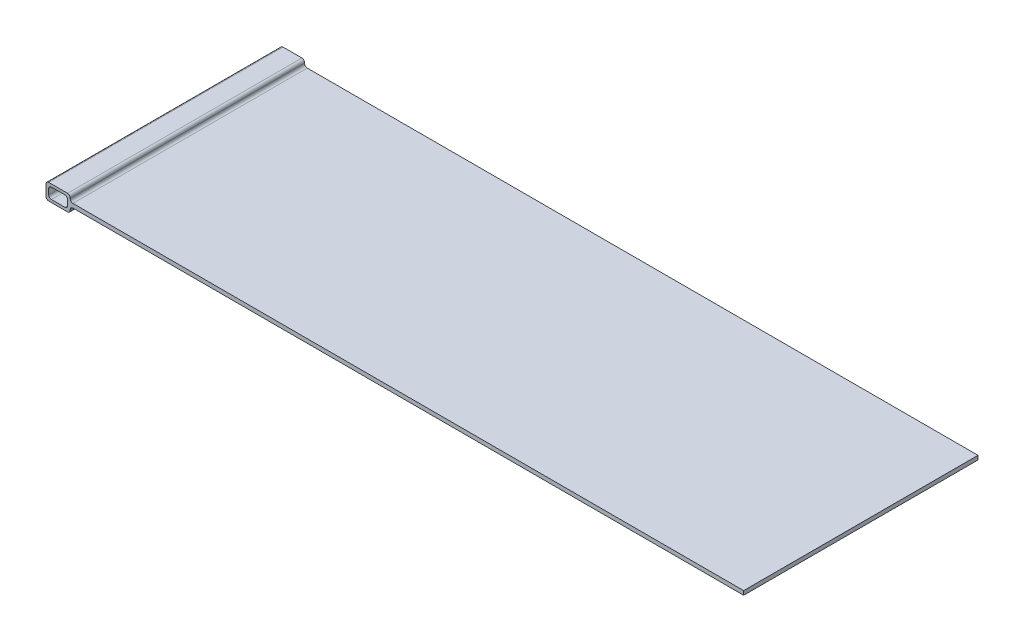
from build123d import *

# Parameters (mm, degrees)
EXTRUDE_1_DEPTH     = 87
CUT_EXTRUDE_1_DEPTH = 274.287394514


with BuildPart() as part:
    # 草图1 → 凸台-拉伸1 (new body)
    with BuildSketch(Plane.XY):
        with BuildLine():
            Line((9, -1.25), (9, -1))
            ThreePointArc((9, -1), (8.707106781, -0.292893219), (8, 0))
            Line((8, 0), (1, 0))
            ThreePointArc((1, 0), (0.292893219, -0.292893219), (0, -1))
            Line((0, -1), (0, -5))
            ThreePointArc((0, -5), (0.292893219, -5.707106781), (1, -6))
            Line((1, -6), (8, -6))
            ThreePointArc((8, -6), (8.707106781, -5.707106781), (9, -5))
            Line((9, -5), (9, -4.75))
            ThreePointArc((9, -4.75), (9.292893219, -4.042893219), (10, -3.75))
            Line((10, -3.75), (259, -3.75))
            Line((259, -3.75), (259, -2.25))
            Line((259, -2.25), (10, -2.25))
            ThreePointArc((10, -2.25), (9.292893219, -1.957106781), (9, -1.25))
        make_face()
    extrude(amount=EXTRUDE_1_DEPTH)

    # 草图2 → 切除-拉伸1 (cut, through all)
    with BuildSketch(Plane.XY.offset(87)):
        with BuildLine():
            Line((2, -1), (7, -1))
            ThreePointArc((7, -1), (7.707106781, -1.292893219), (8, -2))
            Line((8, -2), (8, -4))
            ThreePointArc((8, -4), (7.707106781, -4.707106781), (7, -5))
            Line((7, -5), (2, -5))
            ThreePointArc((2, -5), (1.292893219, -4.707106781), (1, -4))
            Line((1, -4), (1, -2))
            ThreePointArc((1, -2), (1.292893219, -1.292893219), (2, -1))
        make_face()
    extrude(amount=-CUT_EXTRUDE_1_DEPTH, mode=Mode.SUBTRACT)


solid = part.part
